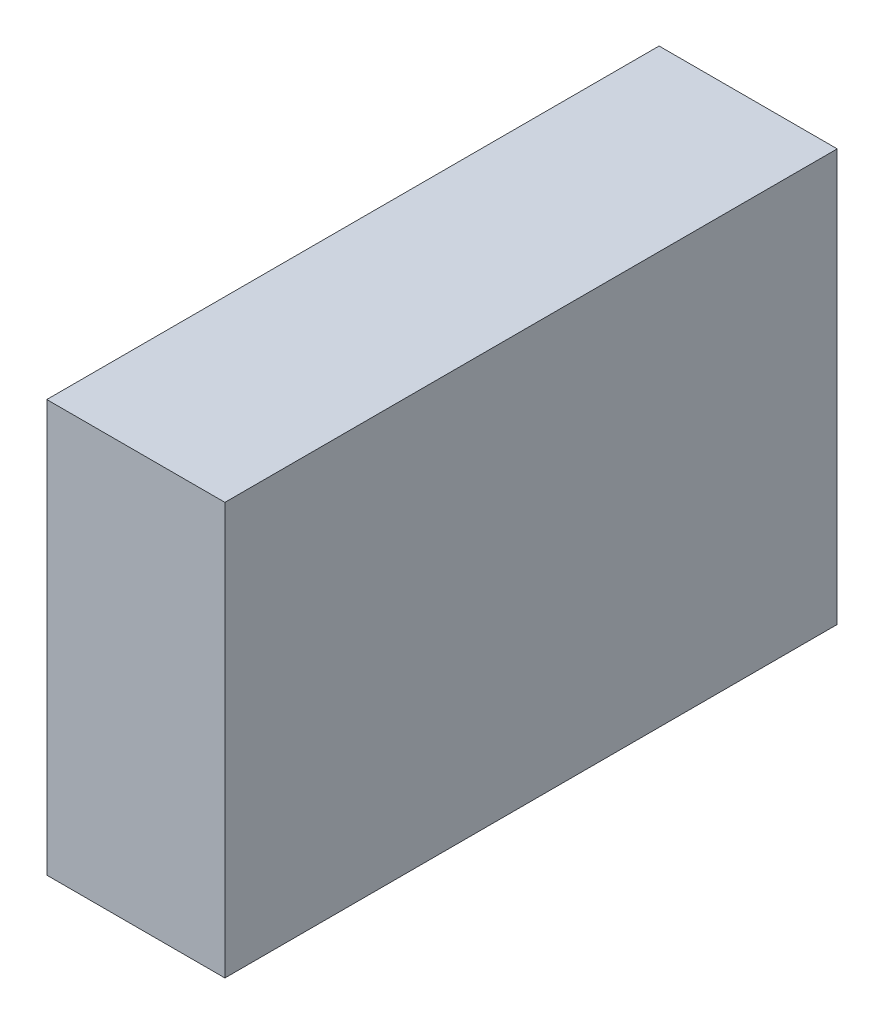
from build123d import *

# Parameters (mm, degrees)
SKETCH1_W           = 55
SKETCH1_H           = 37
BOSS_EXTRUDE1_DEPTH = 16


with BuildPart() as part:
    # Sketch1 → Boss-Extrude1 (new body)
    with BuildSketch(Plane(origin=(0, 0, 0), x_dir=(0, 0, -1), z_dir=(1, 0, 0))):
        Rectangle(SKETCH1_W, SKETCH1_H)
    extrude(amount=BOSS_EXTRUDE1_DEPTH)


solid = part.part
